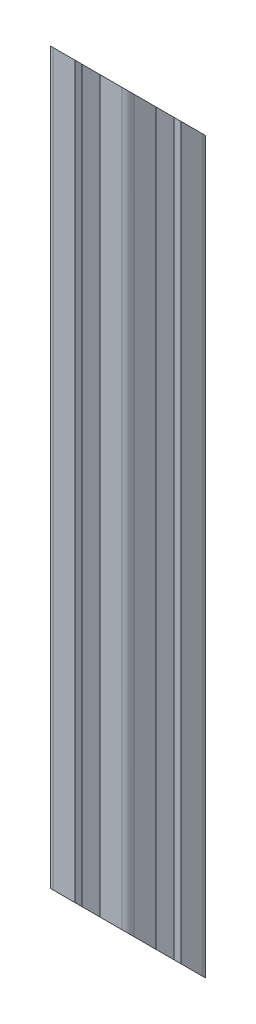
from build123d import *

# Parameters (mm, degrees)
SKETCH_1_R          = 2.5
EXTRUDE_1_DEPTH     = 200
CUT_EXTRUDE_6_DEPTH = 90
CUT_EXTRUDE_7_DEPTH = 203.263183999


with BuildPart() as part:
    # 草图1 → 凸台-拉伸1 (new body)
    with BuildSketch(Plane(origin=(0, 0, 0), x_dir=(1, 0, 0), z_dir=(0, 1, 0))):
        with BuildLine():
            Line((-20.885583918, -15.691936644), (-22.685583918, -15.691936644))
            Line((-22.685583918, -15.691936644), (-22.685583918, -21.091936644))
            ThreePointArc((-22.685583918, -21.091936644), (-22.24624409, -22.152596816), (-21.185583918, -22.591936644))
            Line((-21.185583918, -22.591936644), (-15.785583918, -22.591936644))
            Line((-15.785583918, -22.591936644), (-15.785583918, -20.791936644))
            Line((-15.785583918, -20.791936644), (-18.185583918, -20.791936644))
            Line((-18.185583918, -20.791936644), (-18.185583918, -18.988986799))
            Line((-18.185583918, -18.988986799), (-14.888533763, -15.691936644))
            Line((-14.888533763, -15.691936644), (-10.482634073, -15.691936644))
            Line((-10.482634073, -15.691936644), (-7.185583918, -18.988986799))
            Line((-7.185583918, -18.988986799), (-7.185583918, -20.791936644))
            Line((-7.185583918, -20.791936644), (-9.585583918, -20.791936644))
            Line((-9.585583918, -20.791936644), (-9.585583918, -22.591936644))
            Line((-9.585583918, -22.591936644), (-4.185583918, -22.591936644))
            ThreePointArc((-4.185583918, -22.591936644), (-3.124923747, -22.152596816), (-2.685583918, -21.091936644))
            Line((-2.685583918, -21.091936644), (-2.685583918, -15.691936644))
            Line((-2.685583918, -15.691936644), (-4.485583918, -15.691936644))
            Line((-4.485583918, -15.691936644), (-4.485583918, -18.091936644))
            Line((-4.485583918, -18.091936644), (-6.288533763, -18.091936644))
            Line((-6.288533763, -18.091936644), (-9.631456898, -14.749013509))
            Line((-9.631456898, -14.749013509), (-9.631456898, -10.434859779))
            Line((-9.631456898, -10.434859779), (-6.288533763, -7.091936644))
            Line((-6.288533763, -7.091936644), (-4.485583918, -7.091936644))
            Line((-4.485583918, -7.091936644), (-4.485583918, -9.491936644))
            Line((-4.485583918, -9.491936644), (-2.685583918, -9.491936644))
            Line((-2.685583918, -9.491936644), (-2.685583918, -4.091936644))
            ThreePointArc((-2.685583918, -4.091936644), (-3.124923747, -3.031276473), (-4.185583918, -2.591936644))
            Line((-4.185583918, -2.591936644), (-9.585583918, -2.591936644))
            Line((-9.585583918, -2.591936644), (-9.585583918, -4.391936644))
            Line((-9.585583918, -4.391936644), (-7.185583918, -4.391936644))
            Line((-7.185583918, -4.391936644), (-7.185583918, -6.194886489))
            Line((-7.185583918, -6.194886489), (-10.482634073, -9.491936644))
            Line((-10.482634073, -9.491936644), (-14.888533763, -9.491936644))
            Line((-14.888533763, -9.491936644), (-18.185583918, -6.194886489))
            Line((-18.185583918, -6.194886489), (-18.185583918, -4.391936644))
            Line((-18.185583918, -4.391936644), (-15.785583918, -4.391936644))
            Line((-15.785583918, -4.391936644), (-15.785583918, -2.591936644))
            Line((-15.785583918, -2.591936644), (-21.185583918, -2.591936644))
            ThreePointArc((-21.185583918, -2.591936644), (-22.24624409, -3.031276473), (-22.685583918, -4.091936644))
            Line((-22.685583918, -4.091936644), (-22.685583918, -9.491936644))
            Line((-22.685583918, -9.491936644), (-20.885583918, -9.491936644))
            Line((-20.885583918, -9.491936644), (-20.885583918, -7.091936644))
            Line((-20.885583918, -7.091936644), (-19.082634073, -7.091936644))
            Line((-19.082634073, -7.091936644), (-15.739710939, -10.434859779))
            Line((-15.739710939, -10.434859779), (-15.739710939, -14.749013509))
            Line((-15.739710939, -14.749013509), (-19.082634073, -18.091936644))
            Line((-19.082634073, -18.091936644), (-20.885583918, -18.091936644))
            Line((-20.885583918, -18.091936644), (-20.885583918, -15.691936644))
        make_face()
        with Locations(Location((-12.685583918, -12.591936644, 0), (0, 0, 270))):
            Circle(SKETCH_1_R, mode=Mode.SUBTRACT)
    extrude(amount=EXTRUDE_1_DEPTH)

    # 草图4 → 切除-拉伸6 (cut)
    with BuildSketch(Plane.ZY.offset(22.685583918)):
        Polygon((22.591936644, 200), (2.591936644, 180), (2.591936644, 200), align=None)
    extrude(amount=-CUT_EXTRUDE_6_DEPTH, mode=Mode.SUBTRACT)

    # 草图5 → 切除-拉伸7 (cut, through all)
    with BuildSketch(Plane.ZY.offset(22.685583918)):
        Polygon((2.591936644, 0), (22.591936644, 20), (22.591936644, 0), align=None)
    extrude(amount=-CUT_EXTRUDE_7_DEPTH, mode=Mode.SUBTRACT)


solid = part.part
